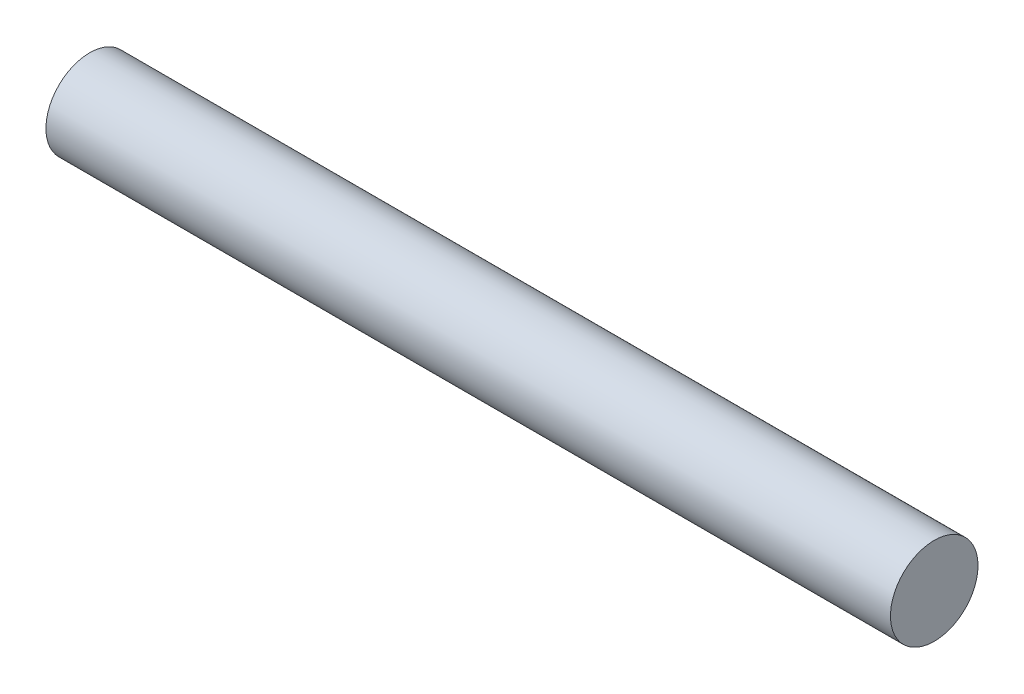
from build123d import *

# Parameters (mm, degrees)
SKETCH_1_R      = 5.7
EXTRUDE_1_DEPTH = 110


with BuildPart() as part:
    # 草图1 → 凸台-拉伸1 (new body)
    with BuildSketch(Plane(origin=(0, 0, 0), x_dir=(0, 0, -1), z_dir=(1, 0, 0))):
        Circle(SKETCH_1_R)
    extrude(amount=EXTRUDE_1_DEPTH)


solid = part.part
